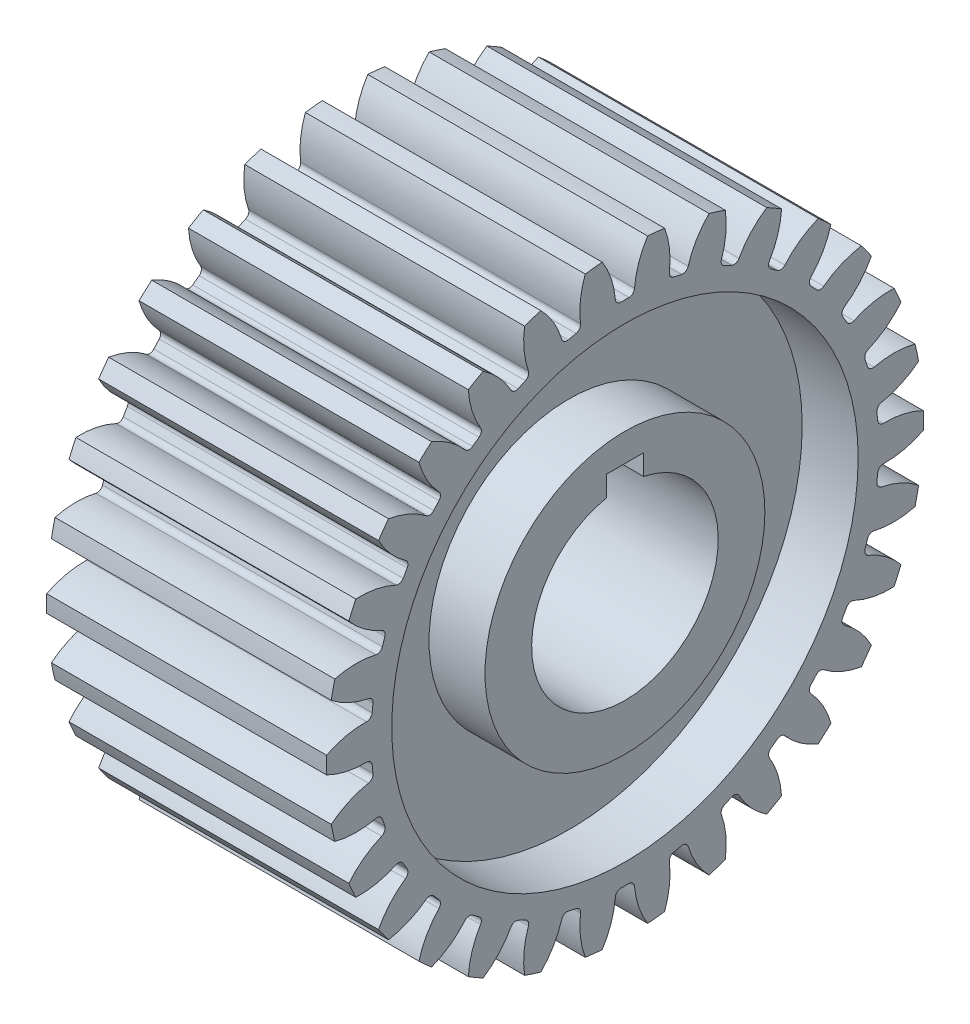
from build123d import *

# Parameters (mm, degrees)
SKETCH3_R           = 16
BOSS_EXTRUDE2_DEPTH = 7.5
CUT_EXTRUDE2_DEPTH  = 28.147743921
SKETCH5_R           = 12.5
SKETCH5_R_2         = 7.5
CUT_EXTRUDE3_DEPTH  = 3
CUT_EXTRUDE4_DEPTH  = 28.147743921
CIRPATTERN2_COUNT   = 30


with BuildPart() as part:
    # Sketch3 → Boss-Extrude2 (new, symmetric)
    with BuildSketch(Plane(origin=(0, 0, 0), x_dir=(0, 0, -1), z_dir=(1, 0, 0))):
        Circle(SKETCH3_R)
    extrude(amount=BOSS_EXTRUDE2_DEPTH, both=True)

    # Sketch4 → Cut-Extrude2 (cut, through all)
    with BuildSketch(Plane(origin=(7.5, 0, 0), x_dir=(0, 0, -1), z_dir=(1, 0, 0))):
        with BuildLine():
            Line((-1, 4.898979486), (-1, 6))
            Line((-1, 6), (1, 6))
            Line((1, 6), (1, 4.898979486))
            ThreePointArc((1, 4.898979486), (0, -5), (-1, 4.898979486))
        make_face()
    extrude(amount=-CUT_EXTRUDE2_DEPTH, mode=Mode.SUBTRACT)

    # Sketch5 → Cut-Extrude3 (cut)
    with BuildSketch(Plane(origin=(7.5, 0, 0), x_dir=(0, 0, -1), z_dir=(1, 0, 0))):
        Circle(SKETCH5_R)
        Circle(SKETCH5_R_2, mode=Mode.SUBTRACT)
    cut_extrude3 = extrude(amount=-CUT_EXTRUDE3_DEPTH, mode=Mode.SUBTRACT)

    # Mirror1: Cut-Extrude3 across plane
    add(cut_extrude3.mirror(Plane(origin=(0, 0, 0), x_dir=(0, 0, 1), z_dir=(1, 0, 0))), mode=Mode.SUBTRACT)

    # Sketch7 → Cut-Extrude4 (cut, through all)
    with BuildSketch(Plane(origin=(7.5, 0, 0), x_dir=(0, 0, -1), z_dir=(1, 0, 0))):
        with BuildLine():
            Line((-0.215504905, 13.6), (0.215504905, 13.6))
            ThreePointArc((0.215504905, 13.6), (0.418677479, 13.679271875), (0.51447758, 13.875193967))
            ThreePointArc((0.51447758, 13.875193967), (0.971129901, 15.519044107), (2, 16.88))
            ThreePointArc((2, 16.88), (0, 16.99145618), (-2, 16.88))
            ThreePointArc((-2, 16.88), (-0.971129901, 15.519044107), (-0.51447758, 13.875193967))
            ThreePointArc((-0.51447758, 13.875193967), (-0.418677479, 13.679271875), (-0.215504905, 13.6))
        make_face()
    cut_extrude4 = extrude(amount=-CUT_EXTRUDE4_DEPTH, mode=Mode.SUBTRACT)

    # CirPattern2: Cut-Extrude4 ×30 about axis
    cirpattern2_axis = Axis((0, 0, 0), (1, 0, 0))
    for i in range(1, CIRPATTERN2_COUNT):
        add(cut_extrude4.rotate(cirpattern2_axis, i * 360 / CIRPATTERN2_COUNT), mode=Mode.SUBTRACT)


solid = part.part
